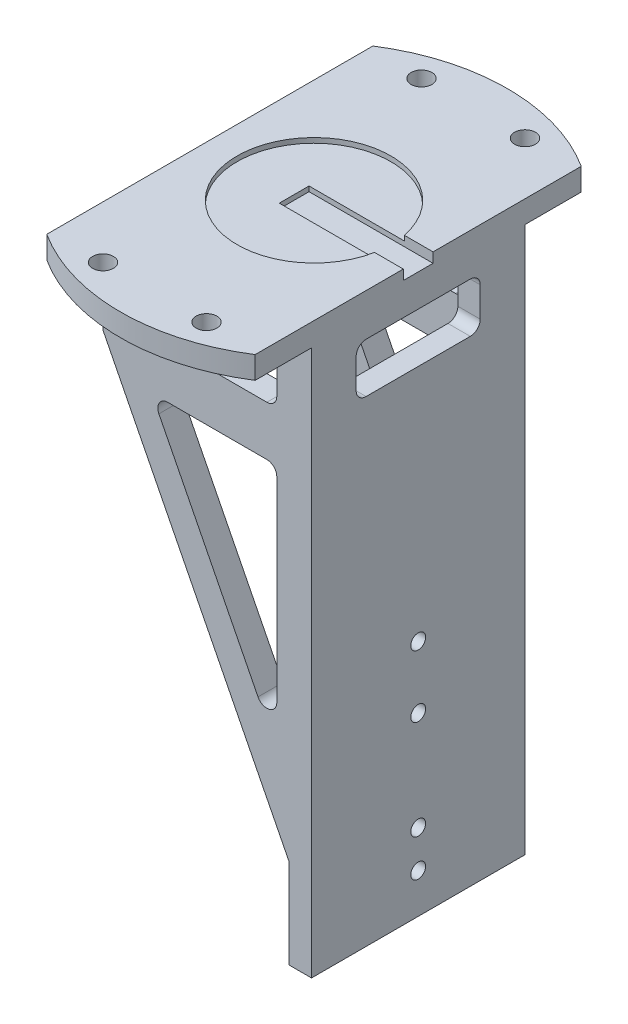
from build123d import *

# Parameters (mm, degrees)
SKETCH1_R           = 2.1
BOSS_EXTRUDE1_DEPTH = 4.5
SKETCH2_R           = 15.5
CUT_EXTRUDE1_DEPTH  = 1
SKETCH3_W           = 25
SKETCH3_H           = 6
CUT_EXTRUDE2_DEPTH  = 2
BOSS_EXTRUDE2_DEPTH = 110
CUT_EXTRUDE3_DEPTH  = 128.284130983
CUT_EXTRUDE4_REACH  = 126.036
SKETCH6_R           = 1.5
CUT_EXTRUDE5_REACH  = 124.586
CUT_EXTRUDE6_DEPTH  = 110


with BuildPart() as part:
    # Sketch1 → Boss-Extrude1 (new body)
    with BuildSketch(Plane(origin=(0, 0, 0), x_dir=(1, 0, 0), z_dir=(0, 1, 0))):
        with BuildLine():
            Line((-21, 32.86335345), (-21, -32.86335345))
            ThreePointArc((-21, -32.86335345), (0, -39), (21, -32.86335345))
            Line((21, -32.86335345), (21, 32.86335345))
            ThreePointArc((21, 32.86335345), (0, 39), (-21, 32.86335345))
        make_face()
        with Locations(Location((10.42932356, 32.098157425, 0), (0, 0, 270))):
            Circle(SKETCH1_R, mode=Mode.SUBTRACT)
        with Locations(Location((-10.42932356, 32.098157425, 0), (0, 0, 270))):
            Circle(SKETCH1_R, mode=Mode.SUBTRACT)
        with Locations(Location((10.42932356, -32.098157425, 0), (0, 0, 270))):
            Circle(SKETCH1_R, mode=Mode.SUBTRACT)
        with Locations(Location((-10.42932356, -32.098157425, 0), (0, 0, 270))):
            Circle(SKETCH1_R, mode=Mode.SUBTRACT)
    extrude(amount=BOSS_EXTRUDE1_DEPTH)

    # Sketch2 → Cut-Extrude1 (cut)
    with BuildSketch(Plane(origin=(0, 4.5, 0), x_dir=(1, 0, 0), z_dir=(0, 1, 0))):
        with Locations(Location((0, 0, 0), (0, 0, 270))):
            Circle(SKETCH2_R)
    extrude(amount=-CUT_EXTRUDE1_DEPTH, mode=Mode.SUBTRACT)

    # Sketch3 → Cut-Extrude2 (cut)
    with BuildSketch(Plane(origin=(0, 4.5, 0), x_dir=(1, 0, 0), z_dir=(0, 1, 0))):
        with Locations((8.5, 0)):
            Rectangle(SKETCH3_W, SKETCH3_H)
    extrude(amount=-CUT_EXTRUDE2_DEPTH, mode=Mode.SUBTRACT)

    # Sketch4 → Boss-Extrude2 (add)
    with BuildSketch(Plane.XZ):
        Polygon((21, 21.5), (-21, 21.5), (-21, 16.5), (-16.5, 16.5), (16.5, 16.5), (16.5, -16.5), (-16.5, -16.5), (-21, -16.5), (-21, -21.5), (21, -21.5), align=None)
    extrude(amount=BOSS_EXTRUDE2_DEPTH)

    # Sketch5 → Cut-Extrude3 (cut, through all)
    with BuildSketch(Plane.XY.offset(21.5)):
        Polygon((-21, -18), (16.5, -110), (16.5, -92), align=None)
    extrude(amount=-CUT_EXTRUDE3_DEPTH, mode=Mode.SUBTRACT)


with BuildPart() as cut_extrude3_kept_piece:
    # of the separate pieces the step leaves, the one the design keeps (cut_extrude3_pieces_kept)
    add(part.part.solids().sort_by_distance((21, 0, -32.86335345))[0])

    # Sketch6 → Cut-Extrude4 (cut, up to next)
    with BuildSketch(Plane(origin=(21, 0, 0), x_dir=(0, 0, -1), z_dir=(1, 0, 0)), mode=Mode.PRIVATE) as cut_extrude4_sk1:
        with Locations((0, -102)):
            Circle(SKETCH6_R)
    cut_extrude4_tool1 = extrude(cut_extrude4_sk1.sketch, amount=-CUT_EXTRUDE4_REACH, mode=Mode.PRIVATE) & cut_extrude3_kept_piece.part
    # Sketch6 → Cut-Extrude4 (cut, up to next)
    with BuildSketch(Plane(origin=(21, 0, 0), x_dir=(0, 0, -1), z_dir=(1, 0, 0)), mode=Mode.PRIVATE) as cut_extrude4_sk2:
        with Locations((0, -94.5)):
            Circle(SKETCH6_R)
    cut_extrude4_tool2 = extrude(cut_extrude4_sk2.sketch, amount=-CUT_EXTRUDE4_REACH, mode=Mode.PRIVATE) & cut_extrude3_kept_piece.part
    # Sketch6 → Cut-Extrude4 (cut, up to next)
    with BuildSketch(Plane(origin=(21, 0, 0), x_dir=(0, 0, -1), z_dir=(1, 0, 0)), mode=Mode.PRIVATE) as cut_extrude4_sk3:
        with Locations((0, -74.5)):
            Circle(SKETCH6_R)
    cut_extrude4_tool3 = extrude(cut_extrude4_sk3.sketch, amount=-CUT_EXTRUDE4_REACH, mode=Mode.PRIVATE) & cut_extrude3_kept_piece.part
    # Sketch6 → Cut-Extrude4 (cut, up to next)
    with BuildSketch(Plane(origin=(21, 0, 0), x_dir=(0, 0, -1), z_dir=(1, 0, 0)), mode=Mode.PRIVATE) as cut_extrude4_sk4:
        with Locations((0, -62)):
            Circle(SKETCH6_R)
    cut_extrude4_tool4 = extrude(cut_extrude4_sk4.sketch, amount=-CUT_EXTRUDE4_REACH, mode=Mode.PRIVATE) & cut_extrude3_kept_piece.part
    add(cut_extrude4_tool1.solids().sort_by_distance((21, -102, 0))[0], mode=Mode.SUBTRACT)
    add(cut_extrude4_tool2.solids().sort_by_distance((21, -94.5, 0))[0], mode=Mode.SUBTRACT)
    add(cut_extrude4_tool3.solids().sort_by_distance((21, -74.5, 0))[0], mode=Mode.SUBTRACT)
    add(cut_extrude4_tool4.solids().sort_by_distance((21, -62, 0))[0], mode=Mode.SUBTRACT)

    # Sketch7 → Cut-Extrude5 (cut, up to next)
    with BuildSketch(Plane.ZY.offset(-16.5), mode=Mode.PRIVATE) as cut_extrude5_sk1:
        with BuildLine():
            Line((-10.5, -4), (10.5, -4))
            ThreePointArc((10.5, -4), (11.914213562, -4.585786438), (12.5, -6))
            Line((12.5, -6), (12.5, -12))
            ThreePointArc((12.5, -12), (11.914213562, -13.414213562), (10.5, -14))
            Line((10.5, -14), (-10.5, -14))
            ThreePointArc((-10.5, -14), (-11.914213562, -13.414213562), (-12.5, -12))
            Line((-12.5, -12), (-12.5, -6))
            ThreePointArc((-12.5, -6), (-11.914213562, -4.585786438), (-10.5, -4))
        make_face()
    cut_extrude5_tool1 = extrude(cut_extrude5_sk1.sketch, amount=-CUT_EXTRUDE5_REACH, mode=Mode.PRIVATE) & cut_extrude3_kept_piece.part
    add(cut_extrude5_tool1.solids().sort_by_distance((16.5, -9, 0))[0], mode=Mode.SUBTRACT)

    # Sketch8 → Cut-Extrude6 (cut)
    with BuildSketch(Plane.XY.offset(21.5)):
        with BuildLine():
            Line((-7.977370013, -24), (12, -24))
            ThreePointArc((12, -24), (13.414213562, -24.585786438), (14, -26))
            Line((14, -26), (14, -65.422010158))
            ThreePointArc((14, -65.422010158), (12.46475074, -67.36726252), (10.21599325, -66.326067633))
            Line((10.21599325, -66.326067633), (-9.761376762, -26.904057474))
            ThreePointArc((-9.761376762, -26.904057474), (-9.681499548, -24.953127264), (-7.977370013, -24))
        make_face()
        with BuildLine():
            Line((-12, -14), (12, -14))
            ThreePointArc((12, -14), (13.414213562, -13.414213562), (14, -12))
            Line((14, -12), (14, -6))
            ThreePointArc((14, -6), (13.414213562, -4.585786438), (12, -4))
            Line((12, -4), (-12, -4))
            ThreePointArc((-12, -4), (-13.414213562, -4.585786438), (-14, -6))
            Line((-14, -6), (-14, -12))
            ThreePointArc((-14, -12), (-13.414213562, -13.414213562), (-12, -14))
        make_face()
    extrude(amount=-CUT_EXTRUDE6_DEPTH, mode=Mode.SUBTRACT)


solid = cut_extrude3_kept_piece.part
